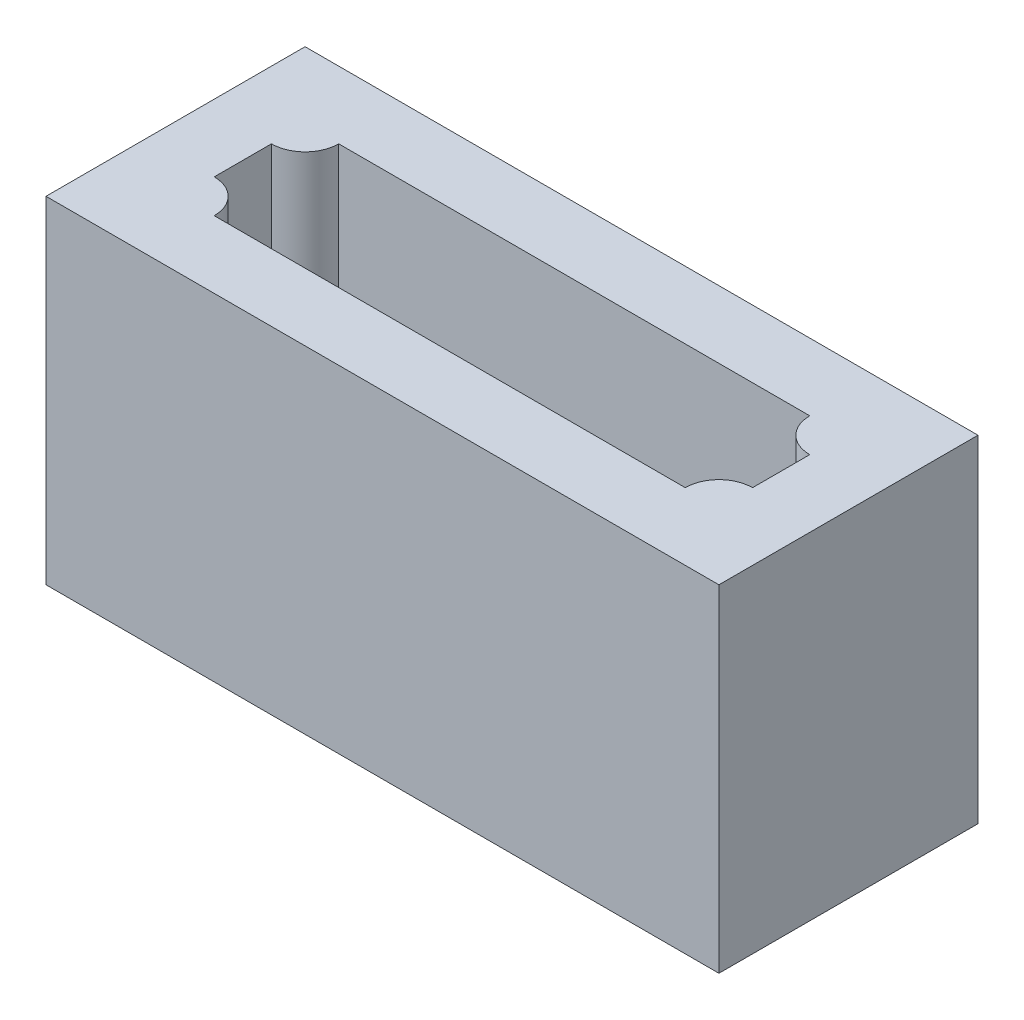
from build123d import *

# Parameters (mm, degrees)
BOSS_EXTRUDE1_DEPTH      = 25
BOSS_EXTRUDE1_DEPTH_BACK = 25
SKETCH1_W                = 100
SKETCH1_H                = 38.5
SKETCH1_W_2              = 80
SKETCH1_H_2              = 18.5
BOSS_EXTRUDE2_DEPTH      = 25
BOSS_EXTRUDE2_DEPTH_BACK = 25
SKETCH2_R                = 5


with BuildPart() as part:
    # Sketch1 → Boss-Extrude1 (new, two sides: drawn at the far end of the back side and taken through both)
    with BuildSketch(Plane(origin=(0, 0, 0), x_dir=(1, 0, 0), z_dir=(0, 1, 0)).offset(-BOSS_EXTRUDE1_DEPTH_BACK)):
        Rectangle(SKETCH1_W, SKETCH1_H)
        Rectangle(SKETCH1_W_2, SKETCH1_H_2, mode=Mode.SUBTRACT)
    extrude(amount=BOSS_EXTRUDE1_DEPTH + BOSS_EXTRUDE1_DEPTH_BACK)

    # Sketch2 → Boss-Extrude2 (add, two sides: drawn at the far end of the back side and taken through both)
    with BuildSketch(Plane(origin=(0, 0, 0), x_dir=(1, 0, 0), z_dir=(0, 1, 0)).offset(-BOSS_EXTRUDE2_DEPTH_BACK)):
        with Locations((40, 9.25)):
            Circle(SKETCH2_R)
        with Locations((40, -9.25)):
            Circle(SKETCH2_R)
        with Locations((-40, 9.25)):
            Circle(SKETCH2_R)
        with Locations((-40, -9.25)):
            Circle(SKETCH2_R)
    extrude(amount=BOSS_EXTRUDE2_DEPTH + BOSS_EXTRUDE2_DEPTH_BACK)


solid = part.part
